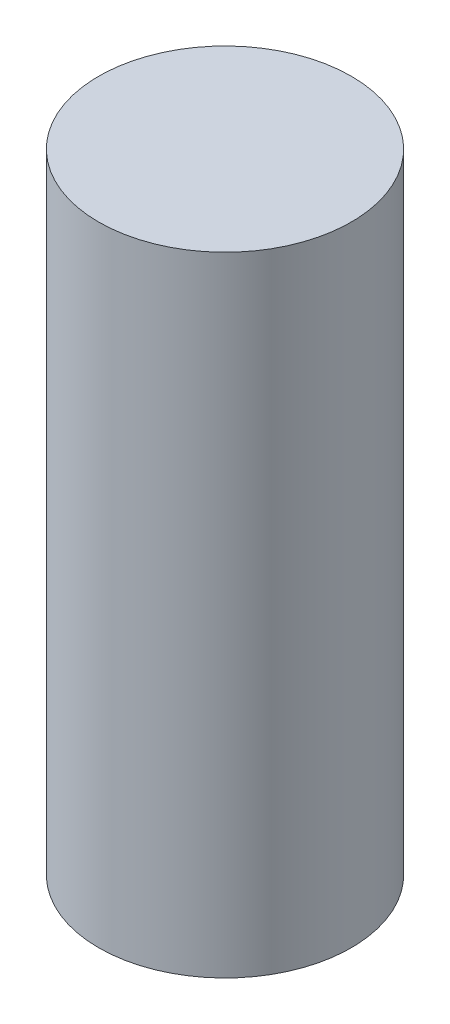
from build123d import *

# Parameters (mm, degrees)
SKETCH1_R           = 2.5527
BOSS_EXTRUDE1_DEPTH = 12.7


with BuildPart() as part:
    # Sketch1 → Boss-Extrude1 (new body)
    with BuildSketch(Plane(origin=(0, 0, 0), x_dir=(1, 0, 0), z_dir=(0, 1, 0))):
        with Locations(Location((0, 0, 0), (0, 0, 270))):
            Circle(SKETCH1_R)
    extrude(amount=BOSS_EXTRUDE1_DEPTH)


solid = part.part
